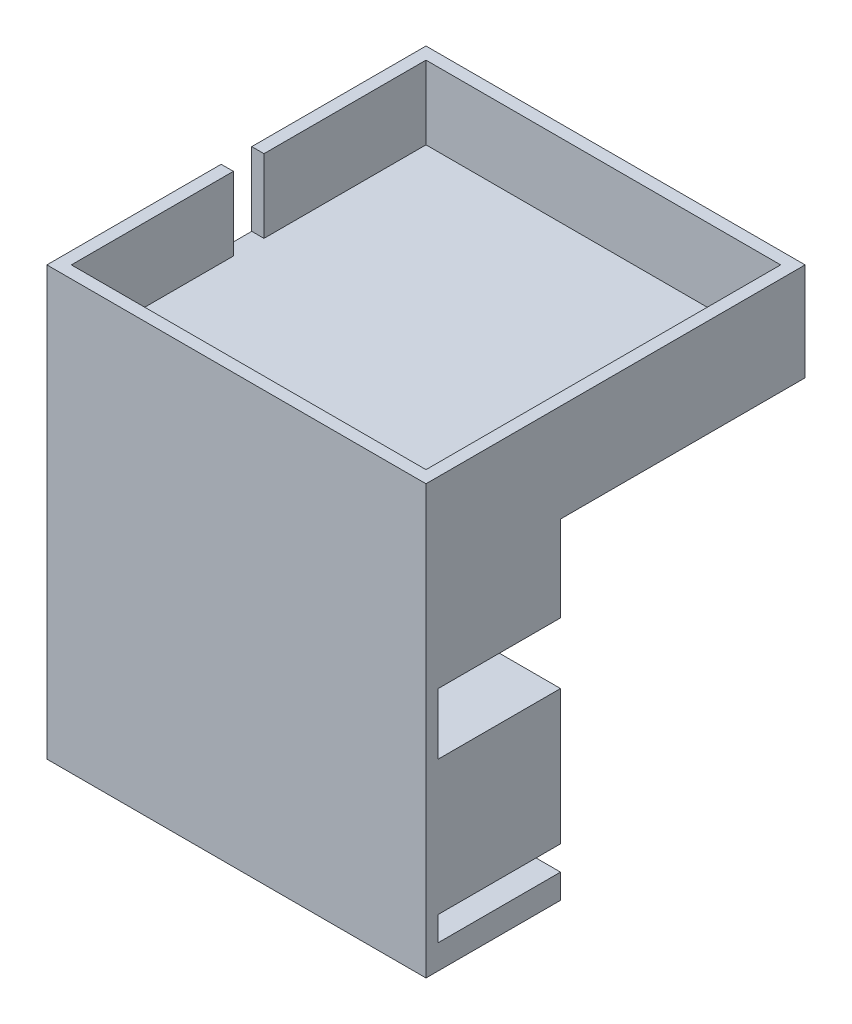
from build123d import *

# Parameters (mm, degrees)
CROQUIS1_W              = 33
CROQUIS1_H              = 33
SALIENTE_EXTRUIR2_DEPTH = 8
VACIADO1_T              = -2
CROQUIS5_W              = 4.422149387
CROQUIS5_H              = 2.5
CORTAR_EXTRUIR3_DEPTH   = 6
CROQUIS6_W              = 32.965049926
CROQUIS6_H              = 12
SALIENTE_EXTRUIR3_DEPTH = 27
CROQUIS7_W              = 32.965049926
CROQUIS7_H              = 2
CORTAR_EXTRUIR4_DEPTH   = 10
CROQUIS8_W              = 10
CROQUIS8_H              = 5
CORTAR_EXTRUIR5_DEPTH   = 10
CROQUIS9_W              = 33
CROQUIS9_H              = 33
CROQUIS9_W_2            = 31
CROQUIS9_H_2            = 31
CORTAR_EXTRUIR6_DEPTH   = 43.065425233


with BuildPart() as part:
    # Croquis1 → Saliente-Extruir2 (new body)
    with BuildSketch(Plane(origin=(0, 0, 0), x_dir=(1, 0, 0), z_dir=(0, 1, 0))):
        Rectangle(CROQUIS1_W, CROQUIS1_H)
    extrude(amount=SALIENTE_EXTRUIR2_DEPTH)

    # Vaciado1
    vaciado1_openings = [part.faces().sort_by_distance(p)[0] for p in [
        (0, 8, 0),
    ]]
    offset(amount=VACIADO1_T, openings=vaciado1_openings, kind=Kind.INTERSECTION)

    # Croquis5 → Cortar-Extruir3 (cut)
    with BuildSketch(Plane(origin=(0, 8, 0), x_dir=(1, 0, 0), z_dir=(0, 1, 0))):
        with Locations((-15.634605234, 0)):
            Rectangle(CROQUIS5_W, CROQUIS5_H)
    extrude(amount=-CORTAR_EXTRUIR3_DEPTH, mode=Mode.SUBTRACT)

    # Croquis6 → Saliente-Extruir3 (add)
    with BuildSketch(Plane.XZ):
        with Locations((0.017475037, 10.5)):
            Rectangle(CROQUIS6_W, CROQUIS6_H)
    extrude(amount=SALIENTE_EXTRUIR3_DEPTH)

    # Croquis7 → Cortar-Extruir4 (cut)
    with BuildSketch(Plane(origin=(0, 0, 4.5), x_dir=(-1, 0, 0), z_dir=(0, 0, -1))):
        with Locations((-0.017475037, -24)):
            Rectangle(CROQUIS7_W, CROQUIS7_H)
        with Locations((-0.017475037, -11)):
            Rectangle(CROQUIS7_W, CROQUIS7_H)
    extrude(amount=-CORTAR_EXTRUIR4_DEPTH, mode=Mode.SUBTRACT)

    # Croquis8 → Cortar-Extruir5 (cut)
    with BuildSketch(Plane(origin=(0, 0, 14.5), x_dir=(-1, 0, 0), z_dir=(0, 0, -1))):
        with Locations((-11.5, -9.5)):
            Rectangle(CROQUIS8_W, CROQUIS8_H)
    extrude(amount=CORTAR_EXTRUIR5_DEPTH, mode=Mode.SUBTRACT)

    # Croquis9 → Cortar-Extruir6 (cut, through all)
    with BuildSketch(Plane(origin=(0, 8, 0), x_dir=(1, 0, 0), z_dir=(0, 1, 0))):
        Rectangle(CROQUIS9_W, CROQUIS9_H)
        Rectangle(CROQUIS9_W_2, CROQUIS9_H_2, mode=Mode.SUBTRACT)
    extrude(amount=-CORTAR_EXTRUIR6_DEPTH, mode=Mode.SUBTRACT)


solid = part.part
